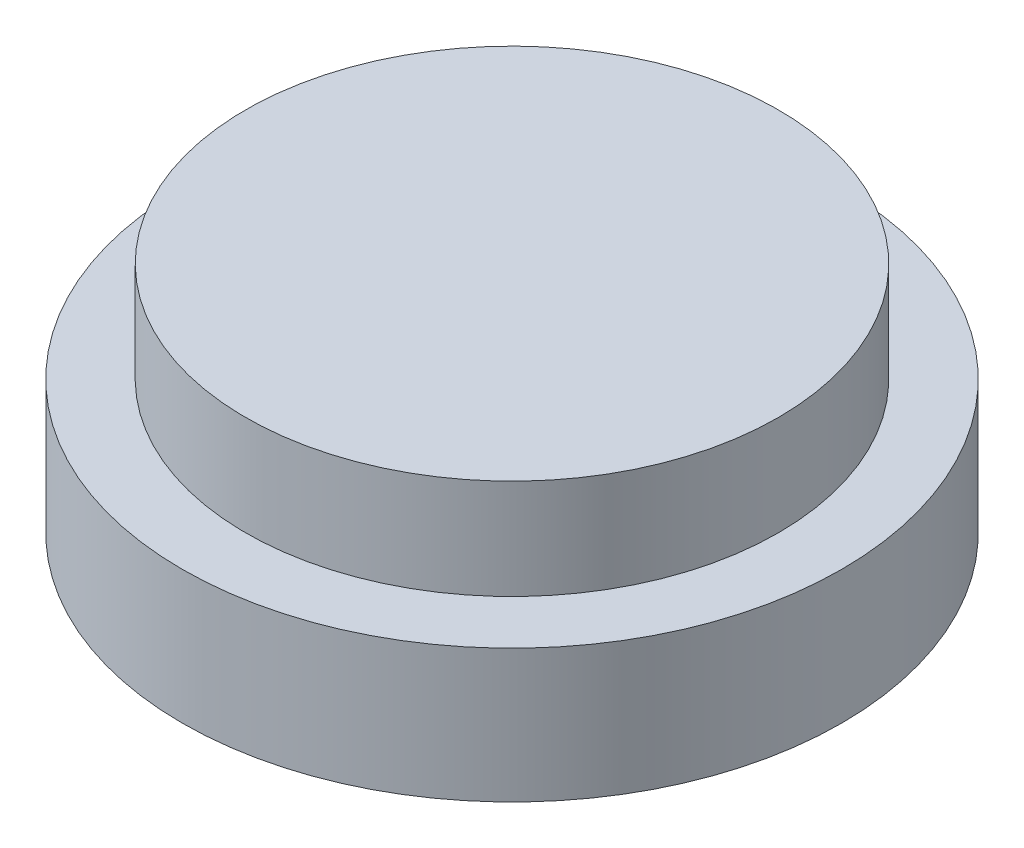
from build123d import *


with BuildPart() as part:
    # Sketch1 → Revolve1 (revolve)
    with BuildSketch(Plane.XY):
        Polygon((0, 0), (0, 63.5), (101.6, 63.5), (101.6, 25.4), (125.73, 25.4), (125.73, -25.4), (78.74, -25.4), (78.74, 0), align=None)
    revolve(axis=Axis((0, 0, 0), (0, 1, 0)))


solid = part.part
